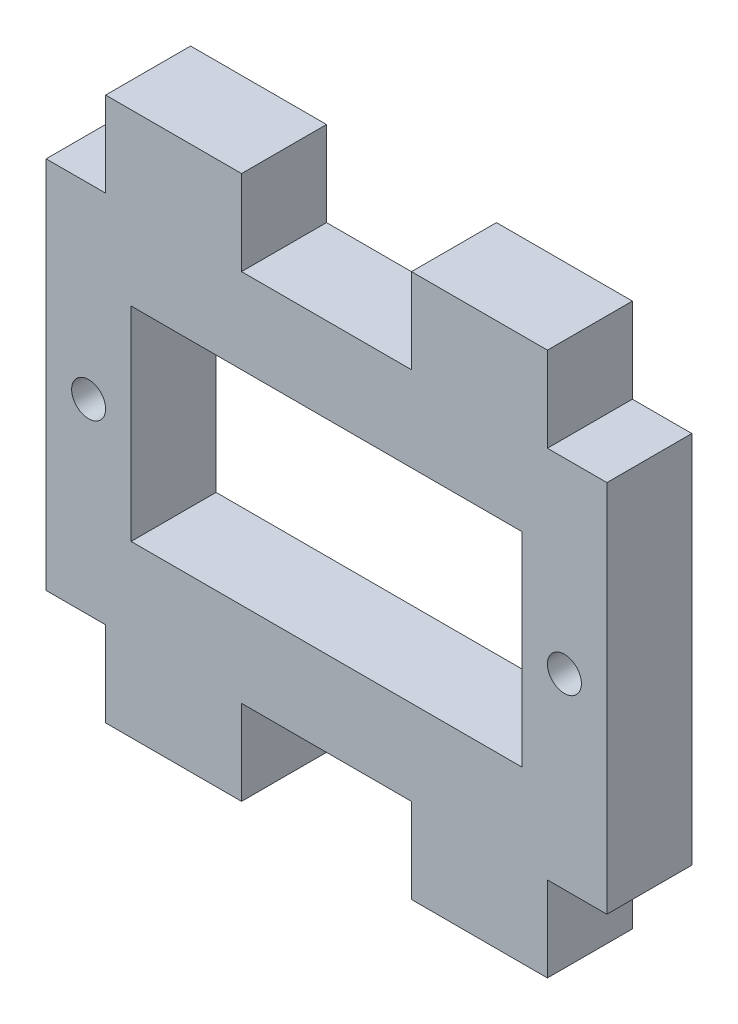
from build123d import *

# Parameters (mm, degrees)
ESQUISSE1_R        = 1
ESQUISSE1_W        = 23
ESQUISSE1_H        = 12.000000104
BOSS_EXTRU_1_DEPTH = 5


with BuildPart() as part:
    # Esquisse1 → Boss.-Extru.1 (new body)
    with BuildSketch(Plane.XY):
        Polygon((5, 11), (5, 16), (13, 16), (13, 11), (16.5, 11), (16.5, -11), (13, -11), (13, -16), (5, -16), (5, -11), (-5, -11), (-5, -16), (-13, -16), (-13, -11), (-16.5, -11), (-16.5, 11), (-13, 11), (-13, 16), (-5, 16), (-5, 11), align=None)
        with Locations((-14, 0)):
            Circle(ESQUISSE1_R, mode=Mode.SUBTRACT)
        with Locations((14, 0)):
            Circle(ESQUISSE1_R, mode=Mode.SUBTRACT)
        Rectangle(ESQUISSE1_W, ESQUISSE1_H, mode=Mode.SUBTRACT)
    extrude(amount=BOSS_EXTRU_1_DEPTH)


solid = part.part
